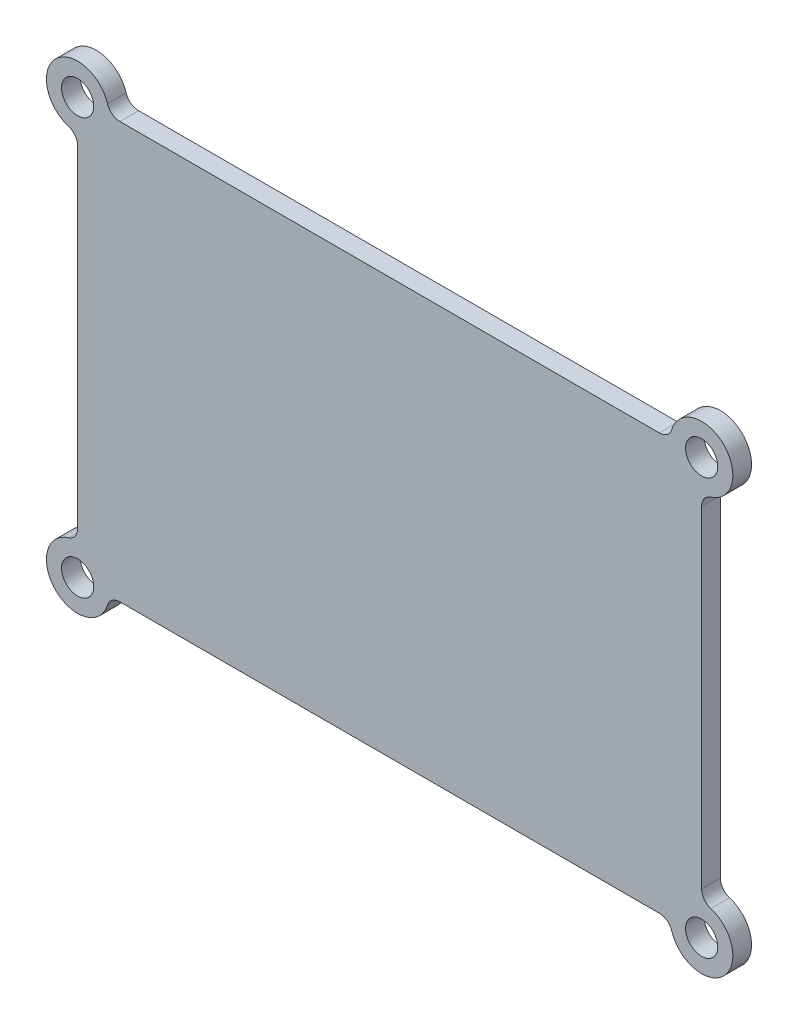
from build123d import *

# Parameters (mm, degrees)
SKETCH_1_R      = 1.55
EXTRUDE_1_DEPTH = 1.8


with BuildPart() as part:
    # 草图1 → 凸台-拉伸1 (new body)
    with BuildSketch(Plane.XY):
        with BuildLine():
            ThreePointArc((0, 35.937980798), (-0.244500417, 36.680591455), (-0.882352941, 37.132692328))
            ThreePointArc((-0.882352941, 37.132692328), (-2.121320344, 42.121320344), (2.867307672, 40.882352941))
            ThreePointArc((2.867307672, 40.882352941), (3.319408545, 40.244500417), (4.062019202, 40))
            Line((4.062019202, 40), (55.937980798, 40))
            ThreePointArc((55.937980798, 40), (56.680591455, 40.244500417), (57.132692328, 40.882352941))
            ThreePointArc((57.132692328, 40.882352941), (62.121320344, 42.121320344), (60.882352941, 37.132692328))
            ThreePointArc((60.882352941, 37.132692328), (60.244500417, 36.680591455), (60, 35.937980798))
            Line((60, 35.937980798), (60, 4.062019202))
            ThreePointArc((60, 4.062019202), (60.244500417, 3.319408545), (60.882352941, 2.867307672))
            ThreePointArc((60.882352941, 2.867307672), (62.121320344, -2.121320344), (57.132692328, -0.882352941))
            ThreePointArc((57.132692328, -0.882352941), (56.680591455, -0.244500417), (55.937980798, 0))
            Line((55.937980798, 0), (4.062019202, 0))
            ThreePointArc((4.062019202, 0), (3.319408545, -0.244500417), (2.867307672, -0.882352941))
            ThreePointArc((2.867307672, -0.882352941), (-2.121320344, -2.121320344), (-0.882352941, 2.867307672))
            ThreePointArc((-0.882352941, 2.867307672), (-0.244500417, 3.319408545), (0, 4.062019202))
            Line((0, 4.062019202), (0, 35.937980798))
        make_face()
        Circle(SKETCH_1_R, mode=Mode.SUBTRACT)
        with Locations((60, 0)):
            Circle(SKETCH_1_R, mode=Mode.SUBTRACT)
        with Locations((60, 40)):
            Circle(SKETCH_1_R, mode=Mode.SUBTRACT)
        with Locations((0, 40)):
            Circle(SKETCH_1_R, mode=Mode.SUBTRACT)
    extrude(amount=EXTRUDE_1_DEPTH)


solid = part.part
